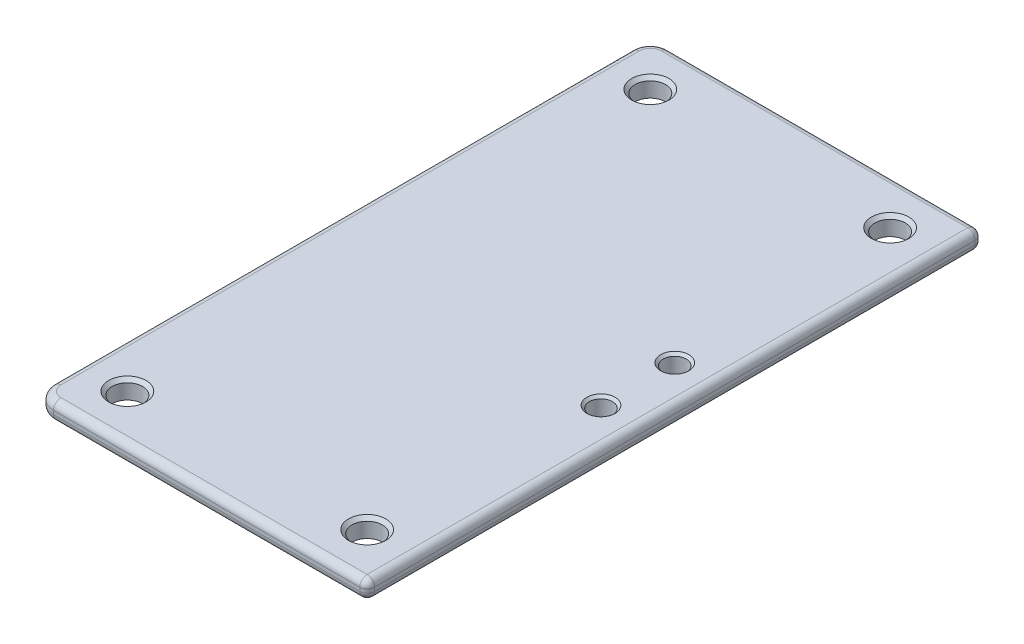
from build123d import *

# Parameters (mm, degrees)
SKETCH_1_W                   = 36
SKETCH_1_H                   = 66.7
EXTRUDE_1_DEPTH              = 2
HOLE_WIZARD_M4_2_AT_2_COUNT  = 2
HOLE_WIZARD_M4_2_AT_2_PITCH  = 56.7
HOLE_WIZARD_M4_2_AT_3_COUNT  = 2
HOLE_WIZARD_M4_2_AT_3_PITCH  = 62.376998966
HOLE_WIZARD_M4_2_AT_4_COUNT  = 2
HOLE_WIZARD_M4_2_AT_4_PITCH  = 26
FILLET_1_R                   = 2
HOLE_WIZARD_M3_1_D           = 2.5
HOLE_WIZARD_M3_1_CSINK_D     = 3.05
HOLE_WIZARD_M3_1_CSINK_ANGLE = 90
FILLET_2_R                   = 0.8


with BuildPart() as part:
    # 草图1 → 凸台-拉伸1 (new body)
    with BuildSketch(Plane(origin=(0, 0, 0), x_dir=(1, 0, 0), z_dir=(0, 1, 0))):
        Rectangle(SKETCH_1_W, SKETCH_1_H)
    extrude(amount=EXTRUDE_1_DEPTH)

    # 草图4 → M4 螺纹孔2 (revolve, cut)
    with BuildSketch(Plane(origin=(-13, 2, 28.35), x_dir=(0, 0, 1), z_dir=(1, 0, 0))):
        Polygon((0, 0), (0, 2), (1.65, 2), (1.65, 0.375), (2.025, 0), align=None)
    hole_wizard_m4_2 = revolve(axis=Axis((-13, 8.35, 28.35), (0, -1, 0)), mode=Mode.SUBTRACT)

    # M4 螺纹孔2 at 2: M4 螺纹孔2 ×2
    with Locations(*[(0, 0, -i * HOLE_WIZARD_M4_2_AT_2_PITCH) for i in range(1, HOLE_WIZARD_M4_2_AT_2_COUNT)]):
        add(hole_wizard_m4_2, mode=Mode.SUBTRACT)

    # M4 螺纹孔2 at 3: M4 螺纹孔2 ×2
    with Locations(*[Vector(0.41682030926474145, 0, -0.9089889052042635) * (i * HOLE_WIZARD_M4_2_AT_3_PITCH) for i in range(1, HOLE_WIZARD_M4_2_AT_3_COUNT)]):
        add(hole_wizard_m4_2, mode=Mode.SUBTRACT)

    # M4 螺纹孔2 at 4: M4 螺纹孔2 ×2
    with Locations(*[(i * HOLE_WIZARD_M4_2_AT_4_PITCH, 0, 0) for i in range(1, HOLE_WIZARD_M4_2_AT_4_COUNT)]):
        add(hole_wizard_m4_2, mode=Mode.SUBTRACT)

    # 圆角1
    fillet_1_edges = [part.edges().sort_by_distance(p)[0] for p in [
        (-18, 1, 33.35),
        (-18, 1, -33.35),
    ]]
    fillet(fillet_1_edges, radius=FILLET_1_R)

    # M3 螺纹孔1 (through all)
    with Locations(Plane(origin=(0, 2, 0), x_dir=(1, 0, 0), z_dir=(0, 1, 0))):
        with Locations((14, -4), (14, 4)):
            CounterSinkHole(HOLE_WIZARD_M3_1_D / 2, HOLE_WIZARD_M3_1_CSINK_D / 2, counter_sink_angle=HOLE_WIZARD_M3_1_CSINK_ANGLE)

    # 圆角2
    fillet_2_edges = [part.edges().sort_by_distance(p)[0] for p in [
        (1, 0, 33.35),
        (1, 2, 33.35),
        (-18, 0, 0),
        (1, 0, -33.35),
        (-17.414213562, 0, -32.764213562),
        (-17.414213562, 0, 32.764213562),
        (-18, 2, 0),
        (1, 2, -33.35),
        (-17.414213562, 2, -32.764213562),
        (-17.414213562, 2, 32.764213562),
        (18, 0, 0),
        (18, 1, -33.35),
        (18, 1, 33.35),
        (18, 2, 0),
    ]]
    fillet(fillet_2_edges, radius=FILLET_2_R)


solid = part.part
